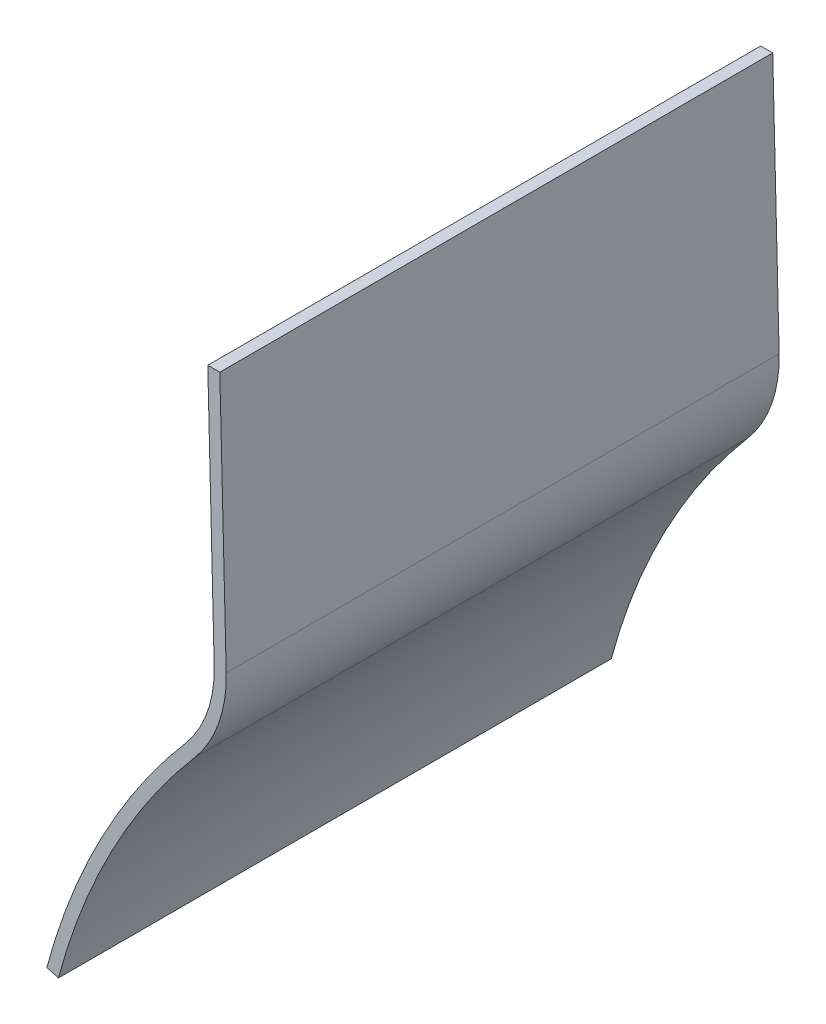
from build123d import *

# Parameters (mm, degrees)
Y_KSEKLIK_EKSTR_ZYON1_DEPTH = 460


with BuildPart() as part:
    # Model → Yükseklik-Ekstrüzyon1 (new body)
    with BuildSketch(Plane.XY):
        with BuildLine():
            Line((2683.361184816, 2448.486053591), (2688.696024406, 2234.457195291))
            ThreePointArc((2688.696024406, 2234.457195291), (2682.394717956, 2194.948295912), (2662.365698433, 2160.314526697))
            ThreePointArc((2662.365698433, 2160.314526697), (2593.65217229, 2058.946023466), (2549.100798322, 1944.874566914))
            Line((2549.100798322, 1944.874566914), (2539.485704518, 1947.628249876))
            ThreePointArc((2539.485704518, 1947.628249876), (2584.84340832, 2063.680353092), (2654.765137408, 2166.813101318))
            ThreePointArc((2654.765137408, 2166.813101318), (2672.971307513, 2198.294836756), (2678.699129435, 2234.20801473))
            Line((2678.699129435, 2234.20801473), (2673.358078821, 2448.486053591))
            Line((2673.358078821, 2448.486053591), (2683.361184816, 2448.486053591))
        make_face()
    extrude(amount=Y_KSEKLIK_EKSTR_ZYON1_DEPTH)


solid = part.part
